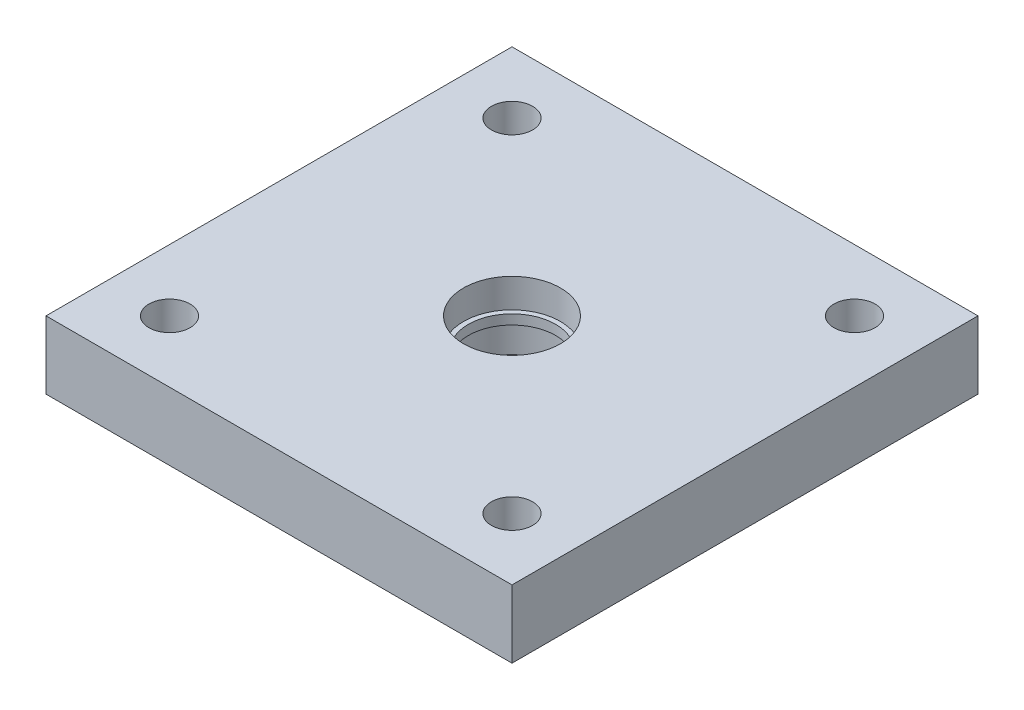
from build123d import *

# Parameters (mm, degrees)
SKETCH1_W                 = 96.210678118
SKETCH1_H                 = 96.210678118
SKETCH1_R                 = 4.25
SKETCH1_R_2               = 9
BODY_AND_MAIN_HOLES_DEPTH = 14
SKETCH2_R                 = 10
SEAL_HOLE_DEPTH           = 6
BEARING_START             = -6
SKETCH3_R                 = 10
BEARING_HOLE_DEPTH        = 6
SKETCH4_R                 = 2
CUT_EXTRUDE1_DEPTH        = 10


with BuildPart() as part:
    # Sketch1 → body and main holes (new body)
    with BuildSketch(Plane(origin=(0, 0, 0), x_dir=(1, 0, 0), z_dir=(0, 1, 0))):
        Rectangle(SKETCH1_W, SKETCH1_H)
        with Locations(Location((-35.355339059, 35.355339059, 0), (0, 0, 270))):
            Circle(SKETCH1_R, mode=Mode.SUBTRACT)
        with Locations(Location((35.355339059, 35.355339059, 0), (0, 0, 270))):
            Circle(SKETCH1_R, mode=Mode.SUBTRACT)
        with Locations(Location((35.355339059, -35.355339059, 0), (0, 0, 270))):
            Circle(SKETCH1_R, mode=Mode.SUBTRACT)
        with Locations(Location((-35.355339059, -35.355339059, 0), (0, 0, 270))):
            Circle(SKETCH1_R, mode=Mode.SUBTRACT)
        with Locations(Location((0, 0, 0), (0, 0, 270))):
            Circle(SKETCH1_R_2, mode=Mode.SUBTRACT)
    extrude(amount=BODY_AND_MAIN_HOLES_DEPTH)

    # Sketch2 → seal hole (cut)
    with BuildSketch(Plane(origin=(0, 14, 0), x_dir=(1, 0, 0), z_dir=(0, 1, 0))):
        with Locations(Location((0, 0, 0), (0, 0, 270))):
            Circle(SKETCH2_R)
    extrude(amount=-SEAL_HOLE_DEPTH, mode=Mode.SUBTRACT)

    # Sketch3 → bearing hole (cut)
    with BuildSketch(Plane.XZ.offset(BEARING_START)):
        with Locations(Location((0, 0, 0), (0, 0, 90))):
            Circle(SKETCH3_R)
    extrude(amount=BEARING_HOLE_DEPTH, mode=Mode.SUBTRACT)

    # Sketch4 → Cut-Extrude1 (cut)
    with BuildSketch(Plane.XZ):
        with Locations(Location((0, -15, 0), (0, 0, 270))):
            Circle(SKETCH4_R)
        with Locations(Location((-15, 0, 0), (0, 0, 270))):
            Circle(SKETCH4_R)
        with Locations(Location((0, 15, 0), (0, 0, 270))):
            Circle(SKETCH4_R)
        with Locations(Location((15, 0, 0), (0, 0, 270))):
            Circle(SKETCH4_R)
    extrude(amount=-CUT_EXTRUDE1_DEPTH, mode=Mode.SUBTRACT)


solid = part.part
